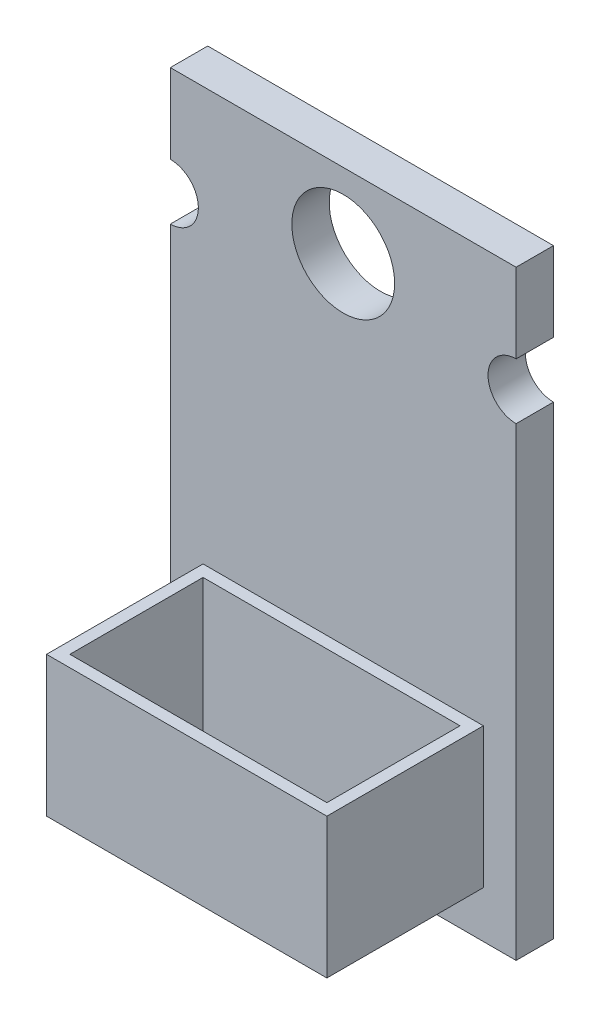
from build123d import *

# Parameters (mm, degrees)
CROQUIS1_R              = 2.2
SALIENTE_EXTRUIR1_DEPTH = 1.6
SALIENTE_EXTRUIR3_START = -2
CROQUIS3_W              = 12
CROQUIS3_H              = 6.7
CROQUIS3_W_2            = 11
CROQUIS3_H_2            = 5.7
SALIENTE_EXTRUIR3_DEPTH = 6


with BuildPart() as part:
    # Croquis1 → Saliente-Extruir1 (new body)
    with BuildSketch(Plane.XY):
        with BuildLine():
            Line((7.4, -12.85), (-7.4, -12.85))
            Line((-7.4, -12.85), (-7.4, 7.05))
            ThreePointArc((-7.4, 7.05), (-6.2, 8.25), (-7.4, 9.45))
            Line((-7.4, 9.45), (-7.4, 12.85))
            Line((-7.4, 12.85), (7.4, 12.85))
            Line((7.4, 12.85), (7.4, 9.45))
            ThreePointArc((7.4, 9.45), (6.2, 8.25), (7.4, 7.05))
            Line((7.4, 7.05), (7.4, -12.85))
        make_face()
        with Locations((0, 9.65)):
            Circle(CROQUIS1_R, mode=Mode.SUBTRACT)
    extrude(amount=SALIENTE_EXTRUIR1_DEPTH)

    # Croquis3 → Saliente-Extruir3 (add)
    with BuildSketch(Plane.XZ.offset(12.85).offset(SALIENTE_EXTRUIR3_START)):
        with Locations((0, 4.95)):
            Rectangle(CROQUIS3_W, CROQUIS3_H)
        with Locations((0, 4.95)):
            Rectangle(CROQUIS3_W_2, CROQUIS3_H_2, mode=Mode.SUBTRACT)
    extrude(amount=-SALIENTE_EXTRUIR3_DEPTH)


solid = part.part
